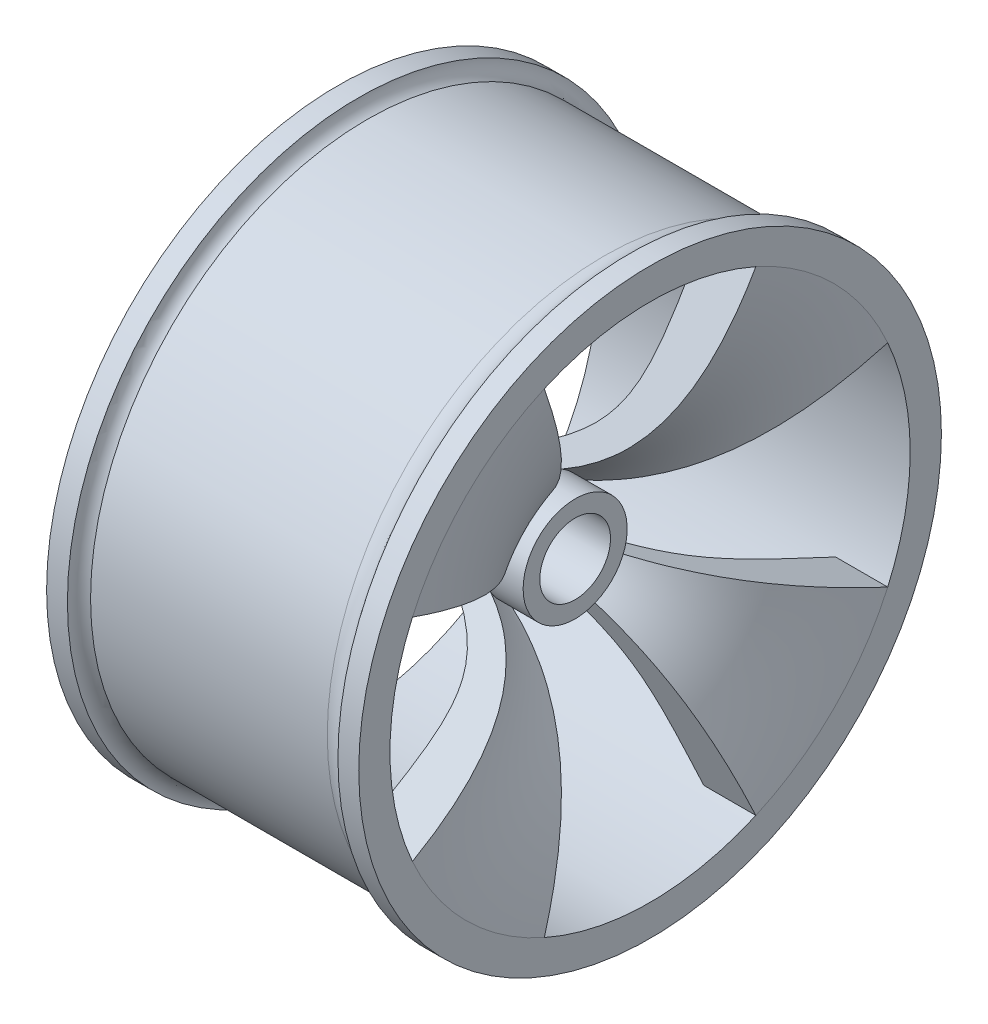
from build123d import *

# Parameters (mm, degrees)
BOSS_EXTRUDE2_REACH             = 213.719
SKETCH2_R                       = 25
SKETCH2_R_2                     = 17
BOSS_EXTRUDE2_DIRECTION_2_DEPTH = 39
CUT_EXTRUDE1_START              = -564
CUT_EXTRUDE1_DEPTH              = 1208
CIRPATTERN1_COUNT               = 4


with BuildPart() as part:
    # Sketch1 → Revolve1 (revolve)
    with BuildSketch(Plane(origin=(0, 0, 0), x_dir=(1, 0, 0), z_dir=(0, 1, 0))):
        with BuildLine():
            Line((-75, 125), (-75, 140))
            Line((-75, 140), (-65, 140))
            ThreePointArc((-65, 140), (-63.891439, 135.936988), (-60.872983, 133))
            Line((-60.872983, 133), (52.875644, 133))
            ThreePointArc((52.875644, 133), (59.875644, 134.875644), (65, 140))
            Line((65, 140), (75, 140))
            Line((75, 140), (75, 125))
            add(Edge.make_bspline(
                [(75, 125), (69.659302, 66.911665), (47.912775, 31.295664), (0, 17)],
                knots=[0, 0, 0, 0, 1, 1, 1, 1], degree=3))
            Line((0, 17), (0, 25))
            add(Edge.make_bspline(
                [(0, 25), (43.410029, 49.810671), (44.443365, 66.931923), (50, 125)],
                knots=[0, 0, 0, 0, 1, 1, 1, 1], degree=3))
            Line((50, 125), (-75, 125))
        make_face()
    revolve(axis=Axis((0, 0, 0), (-1, 0, 0)))

    # Boss-Extrude2: up to this face of the body (flat: up to its plane)
    boss_extrude2_end = Plane(part.part.faces().sort_by_distance((-75, 0, 128.959798))[0])
    # Sketch2 → Boss-Extrude2 (add, up to the picked face)
    with BuildSketch(Plane.ZY, mode=Mode.PRIVATE) as boss_extrude2_sk1:
        Circle(SKETCH2_R)
        Circle(SKETCH2_R_2, mode=Mode.SUBTRACT)
    boss_extrude2_tool1 = split(extrude(boss_extrude2_sk1.sketch, amount=BOSS_EXTRUDE2_REACH, mode=Mode.PRIVATE), bisect_by=boss_extrude2_end, keep=Keep.BOTH, mode=Mode.PRIVATE)
    add(boss_extrude2_tool1.solids().sort_by(Axis((0, 0, -24.292893), (-1, 0, 0)))[0])

    # Sketch2 → Boss-Extrude2 direction 2 (add)
    with BuildSketch(Plane.ZY):
        Circle(SKETCH2_R)
        Circle(SKETCH2_R_2, mode=Mode.SUBTRACT)
    extrude(amount=-BOSS_EXTRUDE2_DIRECTION_2_DEPTH)

    # Sketch3 → Cut-Extrude1 (cut)
    with BuildSketch(Plane(origin=(39, 0, 0), x_dir=(0, 0, -1), z_dir=(1, 0, 0)).offset(CUT_EXTRUDE1_START)):
        with BuildLine():
            Line((-12.5, 21.650635), (-50.833889, 114.196829))
            ThreePointArc((-50.833889, 114.196829), (0, 125), (50.833889, 114.196829))
            Line((50.833889, 114.196829), (12.5, 21.650635))
            ThreePointArc((12.5, 21.650635), (0, 25), (-12.5, 21.650635))
        make_face()
    cut_extrude1 = extrude(amount=CUT_EXTRUDE1_DEPTH, mode=Mode.SUBTRACT)

    # CirPattern1: Cut-Extrude1 ×4 about axis
    cirpattern1_axis = Axis((0, 0, 0), (1, 0, 0))
    for i in range(1, CIRPATTERN1_COUNT):
        add(cut_extrude1.rotate(cirpattern1_axis, i * 360 / CIRPATTERN1_COUNT), mode=Mode.SUBTRACT)


solid = part.part
